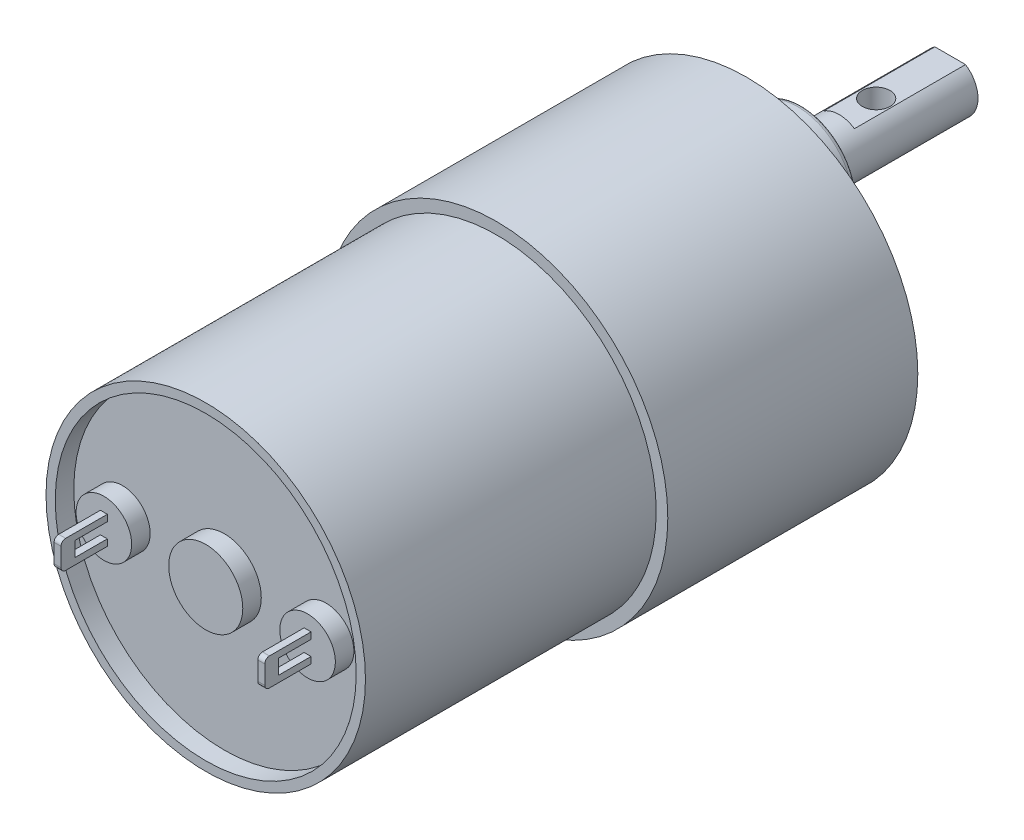
from build123d import *

# Parameters (mm, degrees)
CROQUIS1_R                = 17.25
SALIENTE_EXTRUIR1_DEPTH   = 31.4
CROQUIS2_R                = 18.5
SALIENTE_EXTRUIR2_DEPTH   = 27
CROQUIS3_R                = 6
SALIENTE_EXTRUIR3_DEPTH   = 6
CROQUIS4_R                = 3
SALIENTE_EXTRUIR4_DEPTH   = 16
CORTAR_EXTRUIR1_START     = -12
CORTAR_EXTRUIR1_DEPTH     = 12
CROQUIS8_R                = 16.25
CROQUIS8_R_2              = 4
CORTAR_EXTRUIR2_DEPTH     = 2
CROQUIS9_R                = 3
SALIENTE_EXTRUIR5_DEPTH   = 2
SALIENTE_EXTRUIR5_2_DEPTH = 2
CROQUIS10_W               = 0.75
CROQUIS10_H               = 3
SALIENTE_EXTRUIR6_DEPTH   = 5
SALIENTE_EXTRUIR6_2_DEPTH = 5
CORTAR_EXTRUIR3_START     = -25.375
CROQUIS11_W               = 3.5
CROQUIS11_H               = 1.6
CORTAR_EXTRUIR3_DEPTH     = 28
REDONDEO1_R               = 0.5
REDONDEO2_R               = 0.5
REDONDEO3_R               = 0.5
CROQUIS12_R               = 1.5
CORTAR_EXTRUIR4_DEPTH     = 3
CUT_EXTRUDE1_REACH        = 61.391
CUT_EXTRUDE1_END_RADIUS   = 3
SKETCH1_R                 = 1.5


with BuildPart() as part:
    # Croquis1 → Saliente-Extruir1 (new body)
    with BuildSketch(Plane.XY):
        Circle(CROQUIS1_R)
    extrude(amount=SALIENTE_EXTRUIR1_DEPTH)

    # Croquis2 → Saliente-Extruir2 (add)
    with BuildSketch(Plane(origin=(0, 0, 0), x_dir=(-1, 0, 0), z_dir=(0, 0, -1))):
        Circle(CROQUIS2_R)
    extrude(amount=SALIENTE_EXTRUIR2_DEPTH)

    # Croquis3 → Saliente-Extruir3 (add)
    with BuildSketch(Plane(origin=(0, 0, -27), x_dir=(-1, 0, 0), z_dir=(0, 0, -1))):
        with Locations((0, 7)):
            Circle(CROQUIS3_R)
    extrude(amount=SALIENTE_EXTRUIR3_DEPTH)

    # Croquis4 → Saliente-Extruir4 (add)
    with BuildSketch(Plane(origin=(0, 0, -33), x_dir=(-1, 0, 0), z_dir=(0, 0, -1))):
        with Locations((0, 7)):
            Circle(CROQUIS4_R)
    extrude(amount=SALIENTE_EXTRUIR4_DEPTH)

    # Croquis5 → Cortar-Extruir1 (cut)
    with BuildSketch(Plane(origin=(0, 0, -49), x_dir=(-1, 0, 0), z_dir=(0, 0, -1)).offset(CORTAR_EXTRUIR1_START)):
        with BuildLine():
            Line((-1.658312395, 9.5), (1.658312395, 9.5))
            ThreePointArc((1.658312395, 9.5), (0, 10), (-1.658312395, 9.5))
        make_face()
    extrude(amount=CORTAR_EXTRUIR1_DEPTH, mode=Mode.SUBTRACT)

    # Croquis8 → Cortar-Extruir2 (cut)
    with BuildSketch(Plane.XY.offset(31.4)):
        Circle(CROQUIS8_R)
        Circle(CROQUIS8_R_2, mode=Mode.SUBTRACT)
    extrude(amount=-CORTAR_EXTRUIR2_DEPTH, mode=Mode.SUBTRACT)

    # Redondeo3
    redondeo3_edges = [part.edges().sort_by_distance(p)[0] for p in [
        (6, 7, -33),
    ]]
    fillet(redondeo3_edges, radius=REDONDEO3_R)

    # Croquis12 → Cortar-Extruir4 (cut)
    with BuildSketch(Plane(origin=(0, 0, -27), x_dir=(-1, 0, 0), z_dir=(0, 0, -1))):
        with Locations((-15.5, 0)):
            Circle(CROQUIS12_R)
        with Locations((-7.75, 13.423393759)):
            Circle(CROQUIS12_R)
        with Locations((7.75, 13.423393759)):
            Circle(CROQUIS12_R)
        with Locations((15.5, 0)):
            Circle(CROQUIS12_R)
        with Locations((7.75, -13.423393759)):
            Circle(CROQUIS12_R)
        with Locations((-7.75, -13.423393759)):
            Circle(CROQUIS12_R)
    extrude(amount=-CORTAR_EXTRUIR4_DEPTH, mode=Mode.SUBTRACT)

    # Cut-Extrude1: up to this cylinder (the profile starts inside it)
    cut_extrude1_end = Plane(origin=(0, 7, -41), z_dir=(0, 0, 1)) * Cylinder(CUT_EXTRUDE1_END_RADIUS, 129.782, mode=Mode.PRIVATE)
    # Sketch1 → Cut-Extrude1 (cut, up to the surface)
    with BuildSketch(Plane(origin=(0, 9.5, 0), x_dir=(1, 0, 0), z_dir=(0, 1, 0)), mode=Mode.PRIVATE) as cut_extrude1_sk1:
        with Locations(Location((0, 41, 0), (0, 0, 270))):
            Circle(SKETCH1_R)
    cut_extrude1_tool1 = extrude(cut_extrude1_sk1.sketch, amount=-CUT_EXTRUDE1_REACH, mode=Mode.PRIVATE) & cut_extrude1_end
    add(cut_extrude1_tool1.solids().sort_by_distance((0, 9.5, -41))[0], mode=Mode.SUBTRACT)


with BuildPart() as body_2:
    # Croquis9 → Saliente-Extruir5 (new body)
    with BuildSketch(Plane.XY.offset(29.4)):
        with Locations((-11, 0)):
            Circle(CROQUIS9_R)
    extrude(amount=SALIENTE_EXTRUIR5_DEPTH)


with BuildPart() as body_3:
    # Croquis9 → Saliente-Extruir5 2 (new body)
    with BuildSketch(Plane.XY.offset(29.4)):
        with Locations((11, 0)):
            Circle(CROQUIS9_R)
    extrude(amount=SALIENTE_EXTRUIR5_2_DEPTH)


with BuildPart() as body_4:
    # Croquis10 → Saliente-Extruir6 (new body)
    with BuildSketch(Plane.XY.offset(31.4)):
        with Locations((-11, 0)):
            Rectangle(CROQUIS10_W, CROQUIS10_H)
    extrude(amount=SALIENTE_EXTRUIR6_DEPTH)


with BuildPart() as body_5:
    # Croquis10 → Saliente-Extruir6 2 (new body)
    with BuildSketch(Plane.XY.offset(31.4)):
        with Locations((11, 0)):
            Rectangle(CROQUIS10_W, CROQUIS10_H)
    extrude(amount=SALIENTE_EXTRUIR6_2_DEPTH)


with BuildPart() as cortar_extruir3_tool:
    # Croquis11 → Cortar-Extruir3 (new body)
    with BuildSketch(Plane.ZY.offset(11.375).offset(CORTAR_EXTRUIR3_START)):
        with Locations((33.15, 0)):
            Rectangle(CROQUIS11_W, CROQUIS11_H)
    extrude(amount=CORTAR_EXTRUIR3_DEPTH)


with BuildPart() as body_4_1:
    add(body_4.part)

    # Cortar-Extruir3: cut by cortar_extruir3_tool
    add(cortar_extruir3_tool.part, mode=Mode.SUBTRACT)

    # Redondeo1
    redondeo1_edges = [body_4_1.edges().sort_by_distance(p)[0] for p in [
        (-11, 1.5, 36.4),
        (-11, -1.5, 36.4),
    ]]
    fillet(redondeo1_edges, radius=REDONDEO1_R)


with BuildPart() as body_5_1:
    add(body_5.part)

    # Cortar-Extruir3: cut by cortar_extruir3_tool
    add(cortar_extruir3_tool.part, mode=Mode.SUBTRACT)

    # Redondeo2
    redondeo2_edges = [body_5_1.edges().sort_by_distance(p)[0] for p in [
        (11, 1.5, 36.4),
        (11, -1.5, 36.4),
    ]]
    fillet(redondeo2_edges, radius=REDONDEO2_R)


solid = Compound([part.part, body_2.part, body_3.part, body_4_1.part, body_5_1.part])
